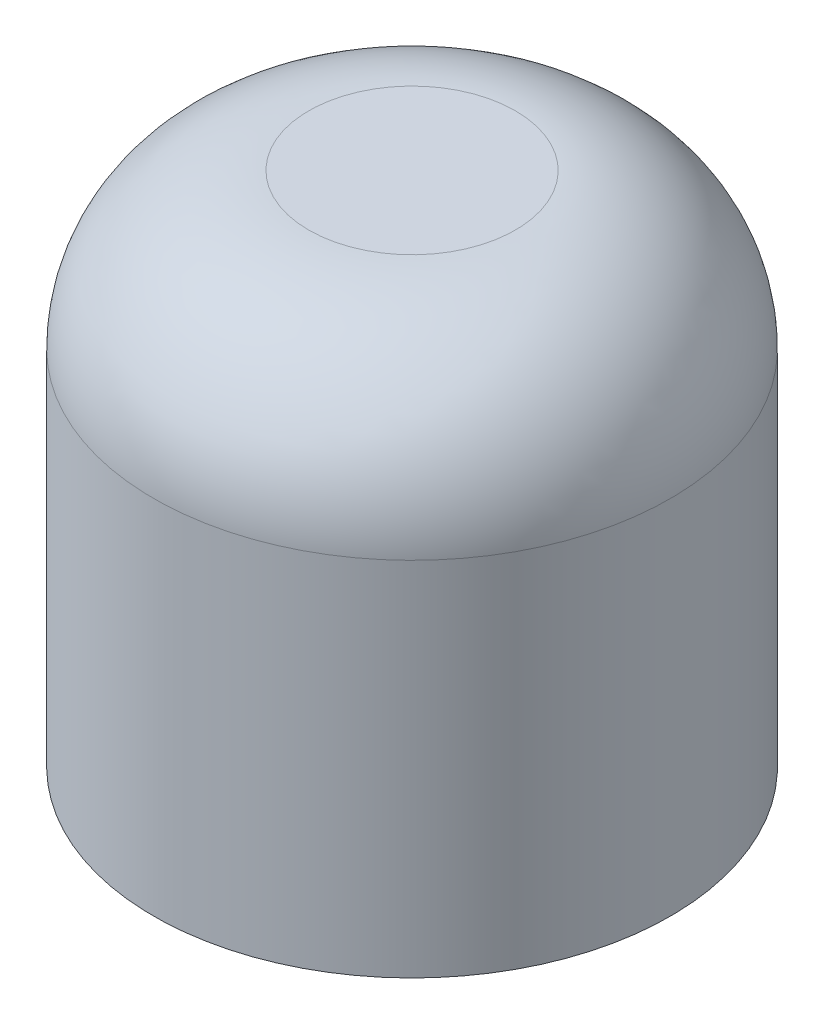
from build123d import *

# Parameters (mm, degrees)
SKETCH1_W          = 6.35
SKETCH1_H          = 12.7
FILLET1_R          = 3.81
SKETCH2_R          = 2.032
CUT_EXTRUDE1_DEPTH = 5.08


with BuildPart() as part:
    # Sketch1 → Revolve3 (revolve)
    with BuildSketch(Plane.XY, mode=Mode.PRIVATE) as revolve3_sk:
        with Locations((-3.175, 6.35)):
            Rectangle(SKETCH1_W, SKETCH1_H)
    revolve(revolve3_sk.sketch.rotate(Axis((0, -6.586539343, 0), (0, 1, 0)), 270), axis=Axis((0, -6.586539343, 0), (0, 1, 0)))

    # Fillet1
    fillet1_edges = [part.edges().sort_by_distance(p)[0] for p in [
        (0, 12.7, 6.35),
    ]]
    fillet(fillet1_edges, radius=FILLET1_R)

    # Sketch2 → Cut-Extrude1 (cut)
    with BuildSketch(Plane(origin=(0, 0, 0), x_dir=(-1, 0, 0), z_dir=(0, -1, 0))):
        with Locations(Location((0, 0, 0), (0, 0, 90))):
            Circle(SKETCH2_R)
    extrude(amount=-CUT_EXTRUDE1_DEPTH, mode=Mode.SUBTRACT)


solid = part.part
